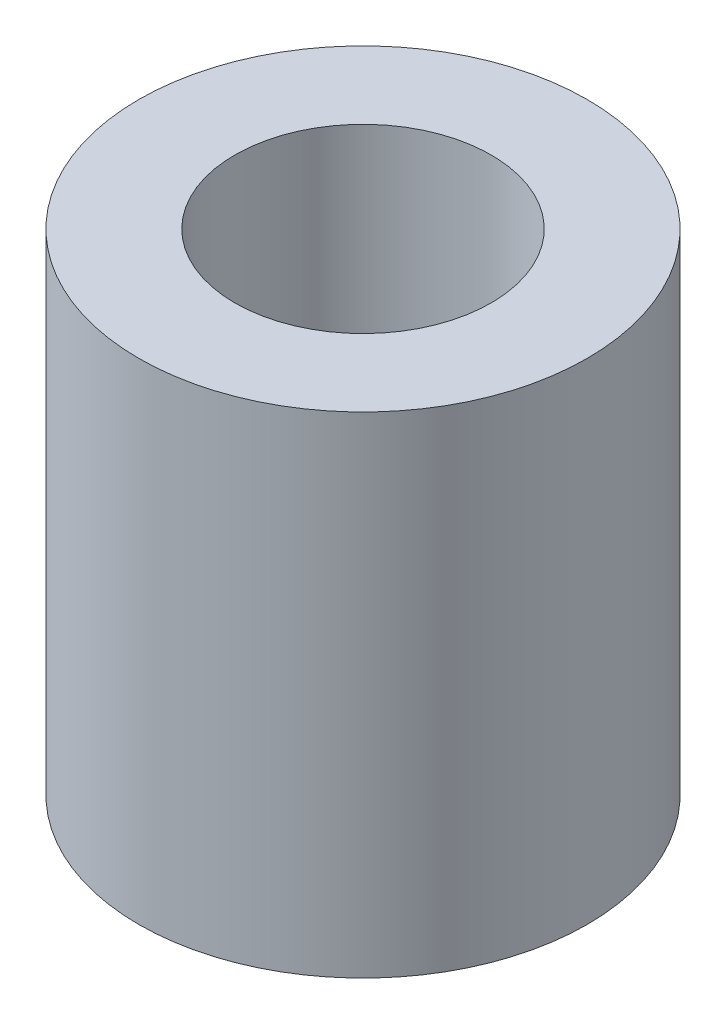
from build123d import *

# Parameters (mm, degrees)
SKETCH2_R           = 5.335
SKETCH2_R_2         = 3.05
BOSS_EXTRUDE1_DEPTH = 11.666


with BuildPart() as part:
    # Sketch2 → Boss-Extrude1 (new body)
    with BuildSketch(Plane(origin=(0, 0, 0), x_dir=(1, 0, 0), z_dir=(0, 1, 0))):
        with Locations(Location((0, 0, 0), (0, 0, 270))):
            Circle(SKETCH2_R)
        with Locations(Location((0, 0, 0), (0, 0, 270))):
            Circle(SKETCH2_R_2, mode=Mode.SUBTRACT)
    extrude(amount=BOSS_EXTRUDE1_DEPTH)


solid = part.part
